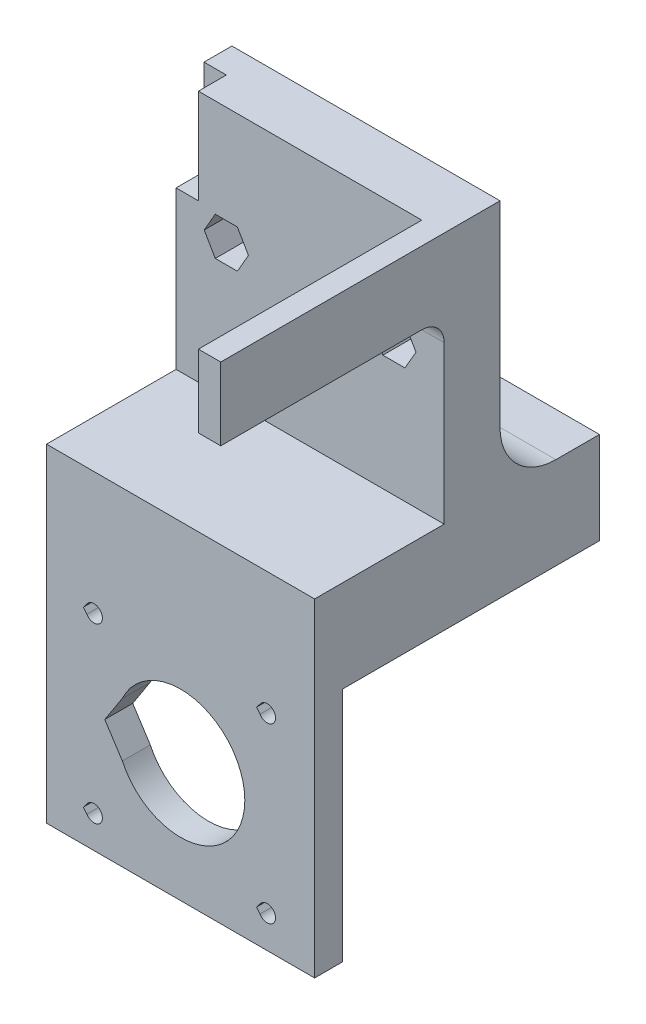
from build123d import *

# Parameters (mm, degrees)
SKETCH1_W            = 48
SKETCH1_H            = 53
BOSS_EXTRUDE1_DEPTH  = 10
SKETCH2_W            = 48
SKETCH2_H            = 5.616325
BOSS_EXTRUDE2_DEPTH  = 33.1917878
SKETCH4_W            = 4
SKETCH4_H            = 10
BOSS_EXTRUDE4_DEPTH  = 40
SKETCH5_W            = 48
SKETCH5_H            = 10.8609375
BOSS_EXTRUDE5_DEPTH  = 23.1917878
SKETCH6_W            = 48
SKETCH6_H            = 5
BOSS_EXTRUDE6_DEPTH  = 42.3
SKETCH7_W            = 12.8082122
SKETCH7_H            = 16.4772625
BOSS_EXTRUDE7_DEPTH  = 48
CUT_EXTRUDE1_REACH   = 84.426
SKETCH8_R            = 11.5
SKETCH8_R_2          = 1.5
FILLET1_R            = 10
FILLET2_R            = 4
SKETCH9_W            = 5
SKETCH9_H            = 16.4772625
BOSS_EXTRUDE9_DEPTH  = 48
CUT_EXTRUDE2_DEPTH   = 6
SKETCH11_R           = 1.9304
CUT_EXTRUDE3_DEPTH   = 6
BOSS_EXTRUDE11_DEPTH = 3
SKETCH14_W           = 45
SKETCH14_H           = 17
CUT_EXTRUDE4_DEPTH   = 4
CUT_EXTRUDE5_REACH   = 88.925


with BuildPart() as part:
    # Sketch1 → Boss-Extrude1 (new body)
    with BuildSketch(Plane.XY):
        with Locations((24, 26.5)):
            Rectangle(SKETCH1_W, SKETCH1_H)
    extrude(amount=BOSS_EXTRUDE1_DEPTH)

    # Sketch2 → Boss-Extrude2 (add)
    with BuildSketch(Plane(origin=(0, 0, 0), x_dir=(-1, 0, 0), z_dir=(0, 0, -1))):
        with Locations((-24, -2.8081625)):
            Rectangle(SKETCH2_W, SKETCH2_H)
    extrude(amount=-BOSS_EXTRUDE2_DEPTH)

    # Sketch4 → Boss-Extrude4 (add)
    with BuildSketch(Plane.XY.offset(10)):
        with Locations((2, 48)):
            Rectangle(SKETCH4_W, SKETCH4_H)
        with Locations((46, 48)):
            Rectangle(SKETCH4_W, SKETCH4_H)
    extrude(amount=BOSS_EXTRUDE4_DEPTH)

    # Sketch5 → Boss-Extrude5 (add)
    with BuildSketch(Plane.XY.offset(10)):
        with Locations((24, 5.43046875)):
            Rectangle(SKETCH5_W, SKETCH5_H)
    extrude(amount=BOSS_EXTRUDE5_DEPTH)

    # Sketch6 → Boss-Extrude6 (add)
    with BuildSketch(Plane.XZ.offset(5.616325)):
        with Locations((24, 30.6917878)):
            Rectangle(SKETCH6_W, SKETCH6_H)
    extrude(amount=BOSS_EXTRUDE6_DEPTH)

    # Sketch7 → Boss-Extrude7 (add)
    with BuildSketch(Plane.ZY):
        with Locations((-6.4041061, 2.62230625)):
            Rectangle(SKETCH7_W, SKETCH7_H)
    extrude(amount=-BOSS_EXTRUDE7_DEPTH)

    # Sketch8 → Cut-Extrude1 (cut, up to next)
    with BuildSketch(Plane(origin=(0, 0, 28.1917878), x_dir=(-1, 0, 0), z_dir=(0, 0, -1)), mode=Mode.PRIVATE) as cut_extrude1_sk1:
        with Locations((-24, -26.616325)):
            Circle(SKETCH8_R)
    cut_extrude1_tool1 = extrude(cut_extrude1_sk1.sketch, amount=-CUT_EXTRUDE1_REACH, mode=Mode.PRIVATE) & part.part
    # Sketch8 → Cut-Extrude1 (cut, up to next)
    with BuildSketch(Plane(origin=(0, 0, 28.1917878), x_dir=(-1, 0, 0), z_dir=(0, 0, -1)), mode=Mode.PRIVATE) as cut_extrude1_sk2:
        with Locations((-39.5, -11.116325)):
            Circle(SKETCH8_R_2)
    cut_extrude1_tool2 = extrude(cut_extrude1_sk2.sketch, amount=-CUT_EXTRUDE1_REACH, mode=Mode.PRIVATE) & part.part
    # Sketch8 → Cut-Extrude1 (cut, up to next)
    with BuildSketch(Plane(origin=(0, 0, 28.1917878), x_dir=(-1, 0, 0), z_dir=(0, 0, -1)), mode=Mode.PRIVATE) as cut_extrude1_sk3:
        with Locations((-39.5, -42.116325)):
            Circle(SKETCH8_R_2)
    cut_extrude1_tool3 = extrude(cut_extrude1_sk3.sketch, amount=-CUT_EXTRUDE1_REACH, mode=Mode.PRIVATE) & part.part
    # Sketch8 → Cut-Extrude1 (cut, up to next)
    with BuildSketch(Plane(origin=(0, 0, 28.1917878), x_dir=(-1, 0, 0), z_dir=(0, 0, -1)), mode=Mode.PRIVATE) as cut_extrude1_sk4:
        with Locations((-8.5, -11.116325)):
            Circle(SKETCH8_R_2)
    cut_extrude1_tool4 = extrude(cut_extrude1_sk4.sketch, amount=-CUT_EXTRUDE1_REACH, mode=Mode.PRIVATE) & part.part
    # Sketch8 → Cut-Extrude1 (cut, up to next)
    with BuildSketch(Plane(origin=(0, 0, 28.1917878), x_dir=(-1, 0, 0), z_dir=(0, 0, -1)), mode=Mode.PRIVATE) as cut_extrude1_sk5:
        with Locations((-8.5, -42.116325)):
            Circle(SKETCH8_R_2)
    cut_extrude1_tool5 = extrude(cut_extrude1_sk5.sketch, amount=-CUT_EXTRUDE1_REACH, mode=Mode.PRIVATE) & part.part
    add(cut_extrude1_tool1.solids().sort_by_distance((24, -26.616325, 28.191788))[0], mode=Mode.SUBTRACT)
    add(cut_extrude1_tool2.solids().sort_by_distance((39.5, -11.116325, 28.191788))[0], mode=Mode.SUBTRACT)
    add(cut_extrude1_tool3.solids().sort_by_distance((39.5, -42.116325, 28.191788))[0], mode=Mode.SUBTRACT)
    add(cut_extrude1_tool4.solids().sort_by_distance((8.5, -11.116325, 28.191788))[0], mode=Mode.SUBTRACT)
    add(cut_extrude1_tool5.solids().sort_by_distance((8.5, -42.116325, 28.191788))[0], mode=Mode.SUBTRACT)

    # Fillet1
    fillet1_edges = [part.edges().sort_by_distance(p)[0] for p in [
        (24, 10.8609375, 0),
    ]]
    fillet(fillet1_edges, radius=FILLET1_R)

    # Fillet2
    fillet2_edges = [part.edges().sort_by_distance(p)[0] for p in [
        (2, 43, 10),
        (46, 43, 10),
    ]]
    fillet(fillet2_edges, radius=FILLET2_R)

    # Sketch9 → Boss-Extrude9 (add)
    with BuildSketch(Plane(origin=(48, 0, 0), x_dir=(0, 0, -1), z_dir=(1, 0, 0))):
        with Locations((15.3082122, 2.62230625)):
            Rectangle(SKETCH9_W, SKETCH9_H)
    extrude(amount=-BOSS_EXTRUDE9_DEPTH)

    # Sketch10 → Cut-Extrude2 (cut)
    with BuildSketch(Plane.XY.offset(10)):
        Polygon((7.020265927, 38.429), (5.040531854, 35), (7.020265927, 31.571), (10.979734073, 31.571), (12.959468146, 35), (10.979734073, 38.429), align=None)
        Polygon((37.020265927, 31.571), (40.979734073, 31.571), (42.959468146, 35), (40.979734073, 38.429), (37.020265927, 38.429), (35.040531854, 35), align=None)
    extrude(amount=-CUT_EXTRUDE2_DEPTH, mode=Mode.SUBTRACT)

    # Sketch11 → Cut-Extrude3 (cut)
    with BuildSketch(Plane.XY.offset(4)):
        with Locations((9, 35)):
            Circle(SKETCH11_R)
        with Locations((39, 35)):
            Circle(SKETCH11_R)
    extrude(amount=-CUT_EXTRUDE3_DEPTH, mode=Mode.SUBTRACT)

    # Sketch12 → Boss-Extrude11 (add)
    with BuildSketch(Plane(origin=(0, 53, 0), x_dir=(1, 0, 0), z_dir=(0, 1, 0))):
        Polygon((0, 0), (0, -50), (4, -50), (4, -10), (44, -10), (44, -50), (48, -50), (48, 0), align=None)
    extrude(amount=BOSS_EXTRUDE11_DEPTH)

    # Sketch14 → Cut-Extrude4 (cut)
    with BuildSketch(Plane.ZY):
        with Locations((27.5, 47.5)):
            Rectangle(SKETCH14_W, SKETCH14_H)
    extrude(amount=-CUT_EXTRUDE4_DEPTH, mode=Mode.SUBTRACT)

    # Sketch15 → Cut-Extrude5 (cut, up to next)
    with BuildSketch(Plane(origin=(0, 0, 28.1917878), x_dir=(-1, 0, 0), z_dir=(0, 0, -1)), mode=Mode.PRIVATE) as cut_extrude5_sk1:
        with BuildLine():
            Line((-10.43028611, -26.616325), (-13.577258578, -21.756647928))
            ThreePointArc((-13.577258578, -21.756647928), (-12.772544225, -24.127502624), (-12.5, -26.616325))
            ThreePointArc((-12.5, -26.616325), (-12.772544225, -29.105147376), (-13.577258578, -31.476002072))
            Line((-13.577258578, -31.476002072), (-10.43028611, -26.616325))
        make_face()
    cut_extrude5_tool1 = extrude(cut_extrude5_sk1.sketch, amount=-CUT_EXTRUDE5_REACH, mode=Mode.PRIVATE) & part.part
    # Sketch15 → Cut-Extrude5 (cut, up to next)
    with BuildSketch(Plane(origin=(0, 0, 28.1917878), x_dir=(-1, 0, 0), z_dir=(0, 0, -1)), mode=Mode.PRIVATE) as cut_extrude5_sk2:
        with BuildLine():
            Line((-6.602022713, -11.116325), (-7.2091403, -10.352334664))
            ThreePointArc((-7.2091403, -10.352334664), (-7.053229536, -10.720275477), (-7, -11.116325))
            ThreePointArc((-7, -11.116325), (-7.053229536, -11.512374523), (-7.2091403, -11.880315336))
            Line((-7.2091403, -11.880315336), (-6.602022713, -11.116325))
        make_face()
    cut_extrude5_tool2 = extrude(cut_extrude5_sk2.sketch, amount=-CUT_EXTRUDE5_REACH, mode=Mode.PRIVATE) & part.part
    # Sketch15 → Cut-Extrude5 (cut, up to next)
    with BuildSketch(Plane(origin=(0, 0, 28.1917878), x_dir=(-1, 0, 0), z_dir=(0, 0, -1)), mode=Mode.PRIVATE) as cut_extrude5_sk3:
        with BuildLine():
            Line((-37.602022713, -11.116325), (-38.2091403, -10.352334664))
            ThreePointArc((-38.2091403, -10.352334664), (-38.053229536, -10.720275477), (-38, -11.116325))
            ThreePointArc((-38, -11.116325), (-38.053229536, -11.512374523), (-38.2091403, -11.880315336))
            Line((-38.2091403, -11.880315336), (-37.602022713, -11.116325))
        make_face()
    cut_extrude5_tool3 = extrude(cut_extrude5_sk3.sketch, amount=-CUT_EXTRUDE5_REACH, mode=Mode.PRIVATE) & part.part
    # Sketch15 → Cut-Extrude5 (cut, up to next)
    with BuildSketch(Plane(origin=(0, 0, 28.1917878), x_dir=(-1, 0, 0), z_dir=(0, 0, -1)), mode=Mode.PRIVATE) as cut_extrude5_sk4:
        with BuildLine():
            Line((-37.602022713, -42.116325), (-38.2091403, -41.352334664))
            ThreePointArc((-38.2091403, -41.352334664), (-38.053229536, -41.720275477), (-38, -42.116325))
            ThreePointArc((-38, -42.116325), (-38.053229536, -42.512374523), (-38.2091403, -42.880315336))
            Line((-38.2091403, -42.880315336), (-37.602022713, -42.116325))
        make_face()
    cut_extrude5_tool4 = extrude(cut_extrude5_sk4.sketch, amount=-CUT_EXTRUDE5_REACH, mode=Mode.PRIVATE) & part.part
    # Sketch15 → Cut-Extrude5 (cut, up to next)
    with BuildSketch(Plane(origin=(0, 0, 28.1917878), x_dir=(-1, 0, 0), z_dir=(0, 0, -1)), mode=Mode.PRIVATE) as cut_extrude5_sk5:
        with BuildLine():
            Line((-6.602022713, -42.116325), (-7.2091403, -41.352334664))
            ThreePointArc((-7.2091403, -41.352334664), (-7.053229536, -41.720275477), (-7, -42.116325))
            ThreePointArc((-7, -42.116325), (-7.053229536, -42.512374523), (-7.2091403, -42.880315336))
            Line((-7.2091403, -42.880315336), (-6.602022713, -42.116325))
        make_face()
    cut_extrude5_tool5 = extrude(cut_extrude5_sk5.sketch, amount=-CUT_EXTRUDE5_REACH, mode=Mode.PRIVATE) & part.part
    add(cut_extrude5_tool1.solids().sort_by_distance((12.00141, -26.616325, 28.191788))[0], mode=Mode.SUBTRACT)
    add(cut_extrude5_tool2.solids().sort_by_distance((6.903574, -11.116325, 28.191788))[0], mode=Mode.SUBTRACT)
    add(cut_extrude5_tool3.solids().sort_by_distance((37.903574, -11.116325, 28.191788))[0], mode=Mode.SUBTRACT)
    add(cut_extrude5_tool4.solids().sort_by_distance((37.903574, -42.116325, 28.191788))[0], mode=Mode.SUBTRACT)
    add(cut_extrude5_tool5.solids().sort_by_distance((6.903574, -42.116325, 28.191788))[0], mode=Mode.SUBTRACT)


solid = part.part
